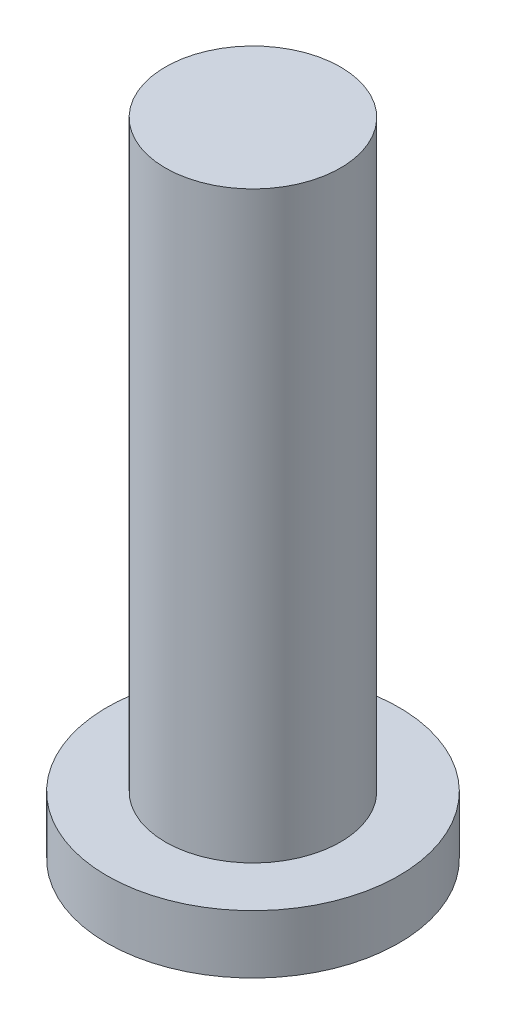
from build123d import *

# Parameters (mm, degrees)
SKETCH2_R           = 12.5
BOSS_EXTRUDE1_DEPTH = 5
SKETCH3_R           = 7.5
BOSS_EXTRUDE2_DEPTH = 50


with BuildPart() as part:
    # Sketch2 → Boss-Extrude1 (new body)
    with BuildSketch(Plane(origin=(0, 0, 0), x_dir=(1, 0, 0), z_dir=(0, 1, 0))):
        with Locations(Location((0, 0, 0), (0, 0, 270))):
            Circle(SKETCH2_R)
    extrude(amount=BOSS_EXTRUDE1_DEPTH)

    # Sketch3 → Boss-Extrude2 (add)
    with BuildSketch(Plane(origin=(0, 5, 0), x_dir=(1, 0, 0), z_dir=(0, 1, 0))):
        with Locations(Location((0, 0, 0), (0, 0, 270))):
            Circle(SKETCH3_R)
    extrude(amount=BOSS_EXTRUDE2_DEPTH)


solid = part.part
